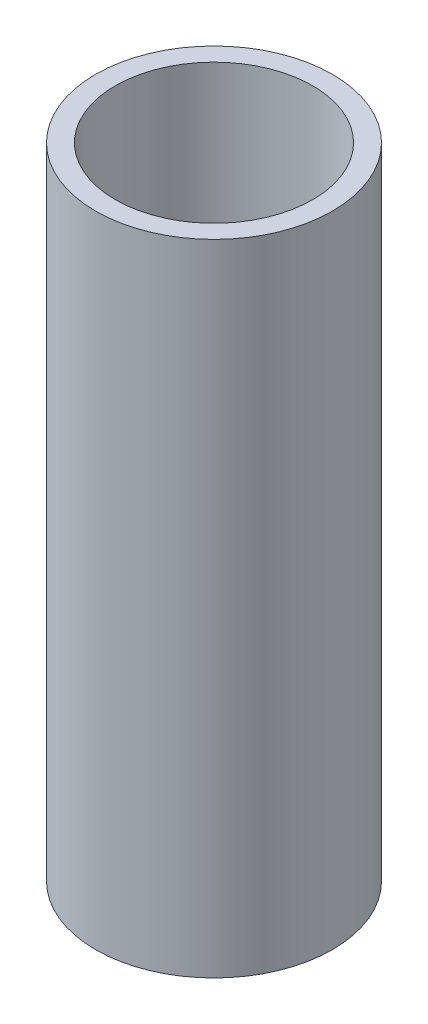
from build123d import *

# Parameters (mm, degrees)
SKETCH1_R           = 30
SKETCH1_R_2         = 25
BOSS_EXTRUDE1_DEPTH = 162


with BuildPart() as part:
    # Sketch1 → Boss-Extrude1 (new body)
    with BuildSketch(Plane(origin=(0, 0, 0), x_dir=(1, 0, 0), z_dir=(0, 1, 0))):
        with Locations(Location((0, 0, 0), (0, 0, 270))):
            Circle(SKETCH1_R)
        with Locations(Location((0, 0, 0), (0, 0, 270))):
            Circle(SKETCH1_R_2, mode=Mode.SUBTRACT)
    extrude(amount=BOSS_EXTRUDE1_DEPTH)


solid = part.part
